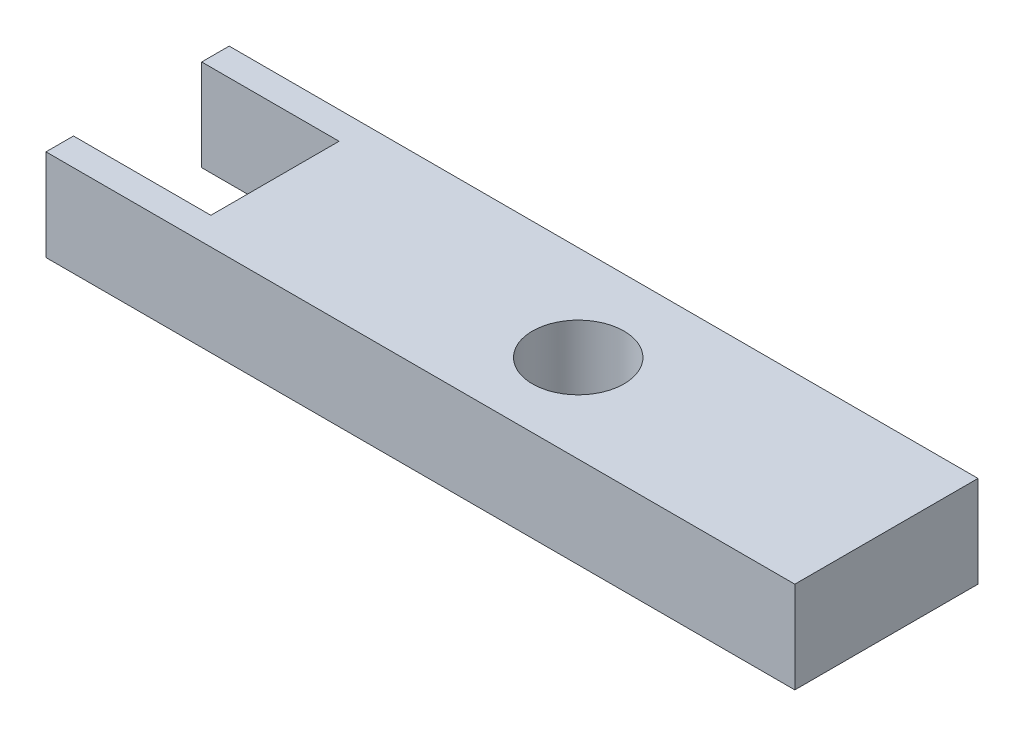
from build123d import *

# Parameters (mm, degrees)
SKETCH1_W           = 58.42
SKETCH1_H           = 10.16
BOSS_EXTRUDE2_DEPTH = 5.08
SKETCH2_W           = 24.504723829
SKETCH2_H           = 7.112
CUT_EXTRUDE1_DEPTH  = 11.938
SKETCH3_W           = 16.975122841
SKETCH3_H           = 18.193068874
CUT_EXTRUDE2_DEPTH  = 11.938
SKETCH4_R           = 2.54
CUT_EXTRUDE3_DEPTH  = 8.382


with BuildPart() as part:
    # Sketch1 → Boss-Extrude2 (new body)
    with BuildSketch(Plane(origin=(0, 0, 0), x_dir=(1, 0, 0), z_dir=(0, 1, 0))):
        with Locations((29.21, -5.08)):
            Rectangle(SKETCH1_W, SKETCH1_H)
    extrude(amount=BOSS_EXTRUDE2_DEPTH)

    # Sketch2 → Cut-Extrude1 (cut)
    with BuildSketch(Plane(origin=(0, 0, 0), x_dir=(1, 0, 0), z_dir=(0, 1, 0))):
        with Locations((12.252361915, -5.08)):
            Rectangle(SKETCH2_W, SKETCH2_H)
    extrude(amount=CUT_EXTRUDE1_DEPTH, mode=Mode.SUBTRACT)

    # Sketch3 → Cut-Extrude2 (cut)
    with BuildSketch(Plane(origin=(0, 0, 0), x_dir=(1, 0, 0), z_dir=(0, 1, 0))):
        with Locations((8.397162409, -3.25308095)):
            Rectangle(SKETCH3_W, SKETCH3_H)
    extrude(amount=CUT_EXTRUDE2_DEPTH, mode=Mode.SUBTRACT)

    # Sketch4 → Cut-Extrude3 (cut)
    with BuildSketch(Plane(origin=(0, 0, 0), x_dir=(1, 0, 0), z_dir=(0, 1, 0))):
        with Locations(Location((41.522723829, -5.27842891, 0), (0, 0, 90))):
            Circle(SKETCH4_R)
    extrude(amount=CUT_EXTRUDE3_DEPTH, mode=Mode.SUBTRACT)


solid = part.part
